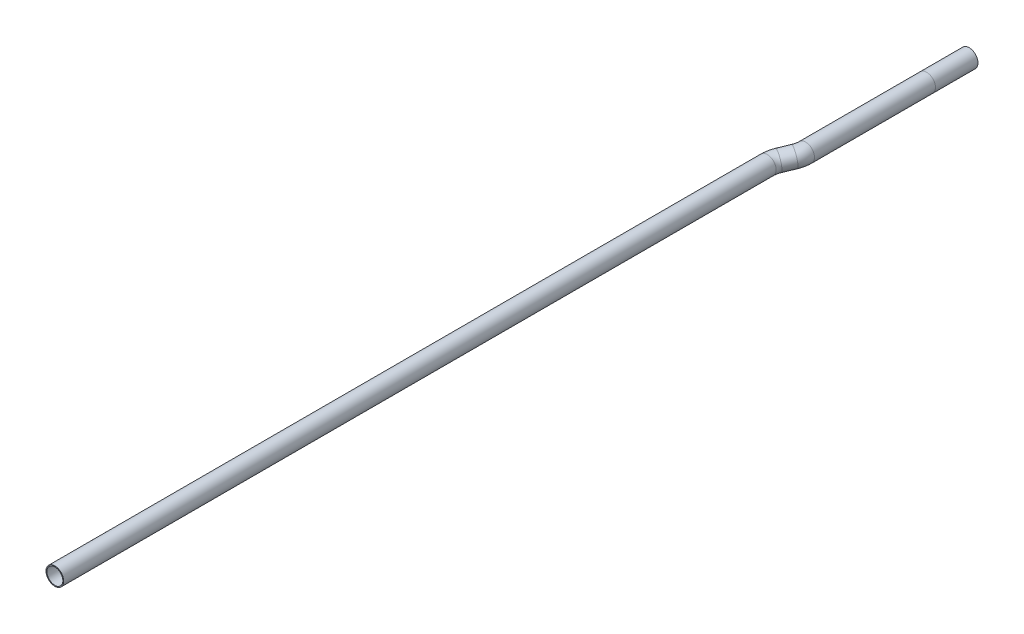
from build123d import *

# Parameters (mm, degrees)
SKETCH1_R   = 3.175
SKETCH1_R_2 = 2.8575


with BuildPart() as part:
    # Sweep1: sweep along a path in Sketch2
    with BuildLine(Plane(origin=(0, 0, 0), x_dir=(0, 0, 1), z_dir=(-0.1950903220161292, 0.9807852804032303, 0))) as sweep1_path:
        Line((-12.7, 3.81), (0, 3.81))
        Line((0, 3.81), (2.54, 3.81))
        Line((2.54, 3.81), (45.877931679, 3.81))
        ThreePointArc((45.877931679, 3.81), (47.521432616, 3.593628997), (49.052931679, 2.959261314))
        Line((49.052931679, 2.959261314), (52.705, 0.850738686))
        ThreePointArc((52.705, 0.850738686), (54.236499064, 0.216371003), (55.88, 0))
        Line((55.88, 0), (311.15, 0))
    # Sketch1 → Sweep1 (sweep)
    with BuildSketch(Plane.XY):
        with Locations((3.736791918, 0.743294127)):
            Circle(SKETCH1_R)
        with Locations((3.736791918, 0.743294127)):
            Circle(SKETCH1_R_2, mode=Mode.SUBTRACT)
    sweep(path=sweep1_path.line)


solid = part.part
